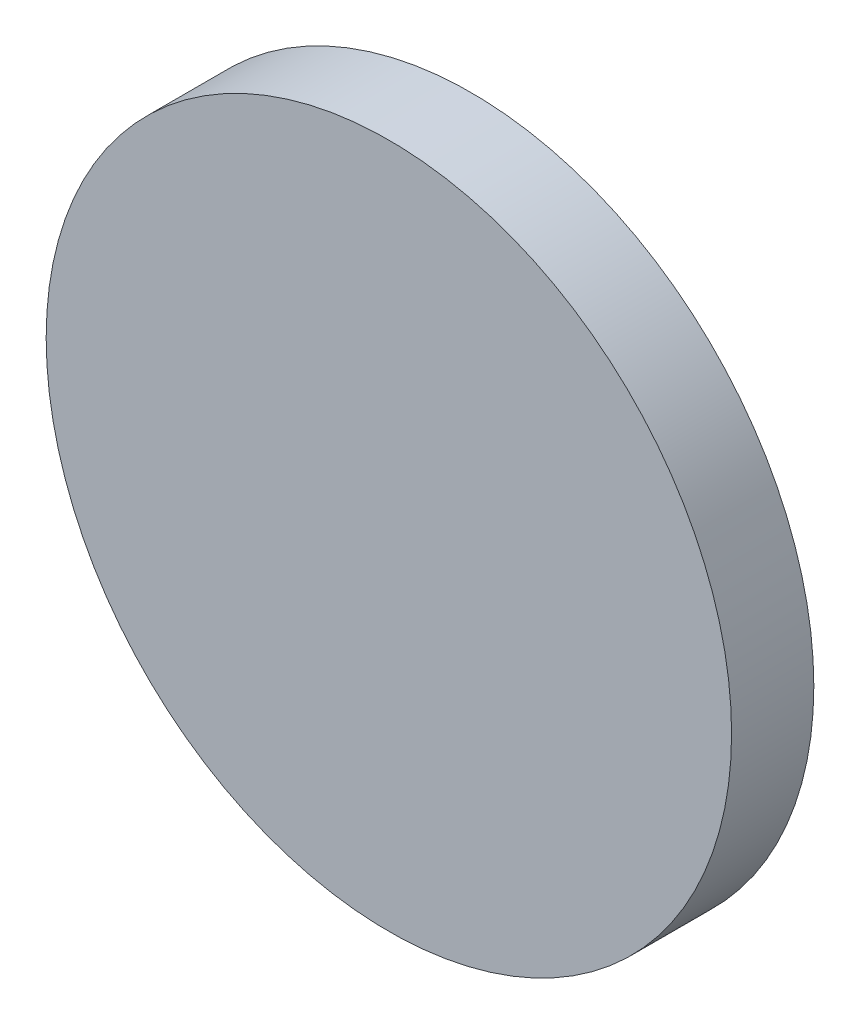
from build123d import *

# Parameters (mm, degrees)
SKETCH1_R           = 6.25
BOSS_EXTRUDE1_DEPTH = 1.5


with BuildPart() as part:
    # Sketch1 → Boss-Extrude1 (new body)
    with BuildSketch(Plane.XY):
        Circle(SKETCH1_R)
    extrude(amount=BOSS_EXTRUDE1_DEPTH)


solid = part.part
